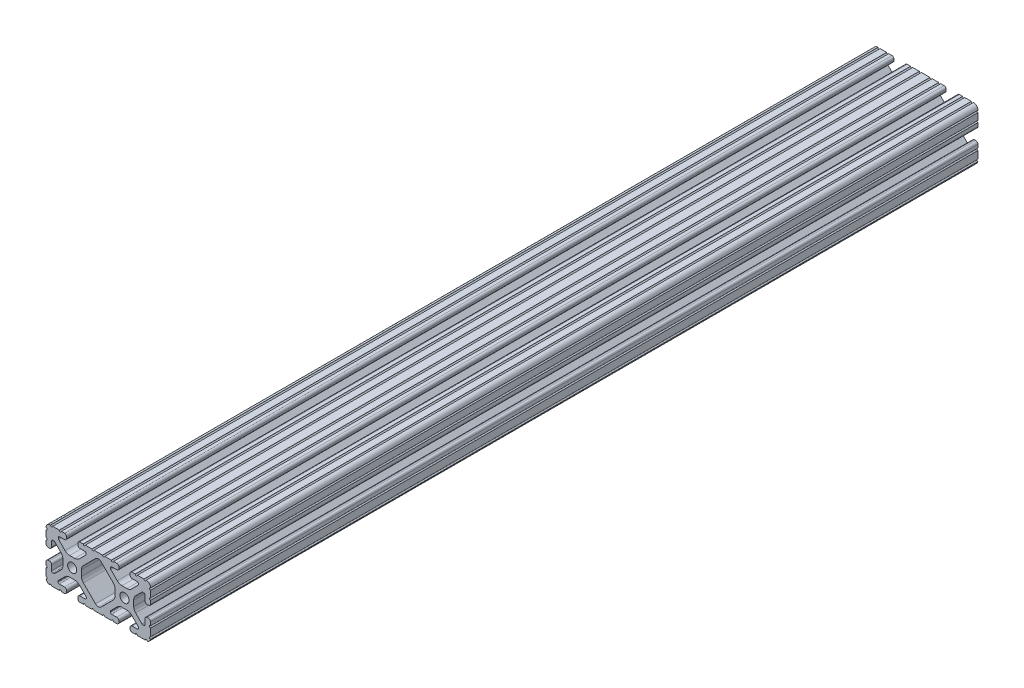
from build123d import *

# Parameters (mm, degrees)
SKETCH1_R      = 3.3274
EXTRUDE1_DEPTH = 603.25


with BuildPart() as part:
    # Sketch1 → Extrude1 (new body)
    with BuildSketch(Plane.XY):
        with BuildLine():
            Line((-3.121121376, -19.05), (3.121121376, -19.05))
            ThreePointArc((3.121121376, -19.05), (3.883121376, -18.288), (4.645121376, -19.05))
            Line((4.645121376, -19.05), (8.633115796, -19.05))
            Line((8.633115796, -19.05), (9.473536067, -19.05))
            ThreePointArc((9.473536067, -19.05), (10.235536067, -18.288), (10.997536067, -19.05))
            Line((10.997536067, -19.05), (13.4112, -19.05))
            ThreePointArc((13.4112, -19.05), (14.524751759, -18.588751759), (14.986, -17.4752))
            Line((14.986, -17.4752), (14.986, -16.5608))
            ThreePointArc((14.986, -16.5608), (14.524751759, -15.447248241), (13.4112, -14.986))
            Line((13.4112, -14.986), (9.652, -14.986))
            ThreePointArc((9.652, -14.986), (9.023382072, -14.725617928), (8.763, -14.097))
            Line((8.763, -14.097), (8.763, -13.687179678))
            ThreePointArc((8.763, -13.687179678), (8.830670671, -13.346975131), (9.023380503, -13.058563318))
            Line((9.023380503, -13.058563318), (13.852498595, -8.229421131))
            ThreePointArc((13.852498595, -8.229421131), (15.393447522, -7.199787805), (17.211122763, -6.838228541))
            Line((17.211122763, -6.838228541), (20.888877237, -6.838228541))
            ThreePointArc((20.888877237, -6.838228541), (22.706552478, -7.199787805), (24.247501405, -8.229421131))
            Line((24.247501405, -8.229421131), (29.076619497, -13.058563318))
            ThreePointArc((29.076619497, -13.058563318), (29.269329329, -13.346975131), (29.337, -13.687179678))
            Line((29.337, -13.687179678), (29.337, -14.097))
            ThreePointArc((29.337, -14.097), (29.076617928, -14.725617928), (28.448, -14.986))
            Line((28.448, -14.986), (24.6888, -14.986))
            ThreePointArc((24.6888, -14.986), (23.575248241, -15.447248241), (23.114, -16.5608))
            Line((23.114, -16.5608), (23.114, -17.4752))
            ThreePointArc((23.114, -17.4752), (23.575248241, -18.588751759), (24.6888, -19.05))
            Line((24.6888, -19.05), (26.945817469, -19.05))
            ThreePointArc((26.945817469, -19.05), (27.707817469, -18.288), (28.469817469, -19.05))
            Line((28.469817469, -19.05), (29.207115796, -19.05))
            Line((29.207115796, -19.05), (34.047273398, -19.05))
            ThreePointArc((34.047273398, -19.05), (34.809273398, -18.288), (35.571273398, -19.05))
            ThreePointArc((35.571273398, -19.05), (37.207577603, -18.182738167), (38.1, -16.560019212))
            ThreePointArc((38.1, -16.560019212), (37.338, -15.798019212), (38.1, -15.036019212))
            Line((38.1, -15.036019212), (38.1, -10.287))
            Line((38.1, -10.287), (38.1, -9.549701672))
            ThreePointArc((38.1, -9.549701672), (37.338, -8.787701672), (38.1, -8.025701672))
            Line((38.1, -8.025701672), (38.1, -5.6388))
            ThreePointArc((38.1, -5.6388), (37.638751759, -4.525248241), (36.5252, -4.064))
            Line((36.5252, -4.064), (35.6108, -4.064))
            ThreePointArc((35.6108, -4.064), (34.497248241, -4.525248241), (34.036, -5.6388))
            Line((34.036, -5.6388), (34.036, -9.398))
            ThreePointArc((34.036, -9.398), (33.775617928, -10.026617928), (33.147, -10.287))
            Line((33.147, -10.287), (32.420656743, -10.287))
            ThreePointArc((32.420656743, -10.287), (32.080450147, -10.21932848), (31.792037247, -10.02661636))
            Line((31.792037247, -10.02661636), (27.197575832, -5.43213202))
            ThreePointArc((27.197575832, -5.43213202), (26.167954729, -3.891188903), (25.8064, -2.07352461))
            Line((25.8064, -2.07352461), (25.8064, 2.07352461))
            ThreePointArc((25.8064, 2.07352461), (26.167954729, 3.891188903), (27.197575832, 5.43213202))
            Line((27.197575832, 5.43213202), (31.792037247, 10.02661636))
            ThreePointArc((31.792037247, 10.02661636), (32.080450147, 10.21932848), (32.420656743, 10.287))
            Line((32.420656743, 10.287), (33.147, 10.287))
            ThreePointArc((33.147, 10.287), (33.775617928, 10.026617928), (34.036, 9.398))
            Line((34.036, 9.398), (34.036, 5.6388))
            ThreePointArc((34.036, 5.6388), (34.497248241, 4.525248241), (35.6108, 4.064))
            Line((35.6108, 4.064), (36.5252, 4.064))
            ThreePointArc((36.5252, 4.064), (37.638751759, 4.525248241), (38.1, 5.6388))
            Line((38.1, 5.6388), (38.1, 8.025701672))
            ThreePointArc((38.1, 8.025701672), (37.338, 8.787701672), (38.1, 9.549701672))
            Line((38.1, 9.549701672), (38.1, 10.287))
            Line((38.1, 10.287), (38.1, 14.375206214))
            ThreePointArc((38.1, 14.375206214), (37.338232276, 15.156019383), (38.137614868, 15.89827725))
            ThreePointArc((38.137614868, 15.89827725), (37.148019028, 18.192014021), (34.819536496, 19.096833012))
            ThreePointArc((34.819536496, 19.096833012), (34.081312886, 18.311776389), (33.296256263, 19.05))
            Line((33.296256263, 19.05), (29.207115796, 19.05))
            Line((29.207115796, 19.05), (28.469817468, 19.05))
            ThreePointArc((28.469817468, 19.05), (27.707817468, 18.288), (26.945817468, 19.05))
            Line((26.945817468, 19.05), (24.558915796, 19.05))
            ThreePointArc((24.558915796, 19.05), (23.53023695, 18.547208069), (23.114, 17.480565346))
            Line((23.114, 17.480565346), (23.114, 16.5608))
            ThreePointArc((23.114, 16.5608), (23.575248241, 15.447248241), (24.6888, 14.986))
            Line((24.6888, 14.986), (28.295243665, 14.986))
            ThreePointArc((28.295243665, 14.986), (28.923861593, 14.725617928), (29.184243665, 14.097))
            Line((29.184243665, 14.097), (29.184243665, 13.53442258))
            ThreePointArc((29.184243665, 13.53442258), (29.116572993, 13.194218033), (28.923863161, 12.90580622))
            Line((28.923863161, 12.90580622), (24.247501405, 8.229421131))
            ThreePointArc((24.247501405, 8.229421131), (22.706552478, 7.199787805), (20.888877237, 6.838228541))
            Line((20.888877237, 6.838228541), (17.211122763, 6.838228541))
            ThreePointArc((17.211122763, 6.838228541), (15.393447522, 7.199787805), (13.852498595, 8.229421131))
            Line((13.852498595, 8.229421131), (9.176136839, 12.90580622))
            ThreePointArc((9.176136839, 12.90580622), (8.983427007, 13.194218033), (8.915756335, 13.53442258))
            Line((8.915756335, 13.53442258), (8.915756335, 14.097))
            ThreePointArc((8.915756335, 14.097), (9.176138407, 14.725617928), (9.804756335, 14.986))
            Line((9.804756335, 14.986), (13.4112, 14.986))
            ThreePointArc((13.4112, 14.986), (14.524751759, 15.447248241), (14.986, 16.5608))
            Line((14.986, 16.5608), (14.986, 17.496772581))
            ThreePointArc((14.986, 17.496772581), (14.531070222, 18.595070222), (13.432772581, 19.05))
            Line((13.432772581, 19.05), (10.997536067, 19.05))
            ThreePointArc((10.997536067, 19.05), (10.235536067, 18.288), (9.473536067, 19.05))
            Line((9.473536067, 19.05), (8.633115796, 19.05))
            Line((8.633115796, 19.05), (4.645121376, 19.05))
            ThreePointArc((4.645121376, 19.05), (3.883121376, 18.288), (3.121121376, 19.05))
            Line((3.121121376, 19.05), (-3.121121376, 19.05))
            ThreePointArc((-3.121121376, 19.05), (-3.883121376, 18.288), (-4.645121376, 19.05))
            Line((-4.645121376, 19.05), (-8.633115796, 19.05))
            Line((-8.633115796, 19.05), (-9.473536067, 19.05))
            ThreePointArc((-9.473536067, 19.05), (-10.235536067, 18.288), (-10.997536067, 19.05))
            Line((-10.997536067, 19.05), (-13.432772581, 19.05))
            ThreePointArc((-13.432772581, 19.05), (-14.531070222, 18.595070222), (-14.986, 17.496772581))
            Line((-14.986, 17.496772581), (-14.986, 16.5608))
            ThreePointArc((-14.986, 16.5608), (-14.524751759, 15.447248241), (-13.4112, 14.986))
            Line((-13.4112, 14.986), (-9.804756335, 14.986))
            ThreePointArc((-9.804756335, 14.986), (-9.176138407, 14.725617928), (-8.915756335, 14.097))
            Line((-8.915756335, 14.097), (-8.915756335, 13.53442258))
            ThreePointArc((-8.915756335, 13.53442258), (-8.983427007, 13.194218033), (-9.176136839, 12.90580622))
            Line((-9.176136839, 12.90580622), (-13.852498595, 8.229421131))
            ThreePointArc((-13.852498595, 8.229421131), (-15.393447522, 7.199787805), (-17.211122763, 6.838228541))
            Line((-17.211122763, 6.838228541), (-20.888877237, 6.838228541))
            ThreePointArc((-20.888877237, 6.838228541), (-22.706552478, 7.199787805), (-24.247501405, 8.229421131))
            Line((-24.247501405, 8.229421131), (-28.923863161, 12.90580622))
            ThreePointArc((-28.923863161, 12.90580622), (-29.116572993, 13.194218033), (-29.184243665, 13.53442258))
            Line((-29.184243665, 13.53442258), (-29.184243665, 14.097))
            ThreePointArc((-29.184243665, 14.097), (-28.923861593, 14.725617928), (-28.295243665, 14.986))
            Line((-28.295243665, 14.986), (-24.6888, 14.986))
            ThreePointArc((-24.6888, 14.986), (-23.575248241, 15.447248241), (-23.114, 16.5608))
            Line((-23.114, 16.5608), (-23.114, 17.480565346))
            ThreePointArc((-23.114, 17.480565346), (-23.53023695, 18.547208069), (-24.558915796, 19.05))
            Line((-24.558915796, 19.05), (-26.945817468, 19.05))
            ThreePointArc((-26.945817468, 19.05), (-27.707817468, 18.288), (-28.469817468, 19.05))
            Line((-28.469817468, 19.05), (-29.207115796, 19.05))
            Line((-29.207115796, 19.05), (-33.296256263, 19.05))
            ThreePointArc((-33.296256263, 19.05), (-34.081312886, 18.311776389), (-34.819536496, 19.096833012))
            ThreePointArc((-34.819536496, 19.096833012), (-37.148019028, 18.192014021), (-38.137614868, 15.89827725))
            ThreePointArc((-38.137614868, 15.89827725), (-37.338232276, 15.156019383), (-38.1, 14.375206214))
            Line((-38.1, 14.375206214), (-38.1, 10.287))
            Line((-38.1, 10.287), (-38.1, 9.549701672))
            ThreePointArc((-38.1, 9.549701672), (-37.338, 8.787701672), (-38.1, 8.025701672))
            Line((-38.1, 8.025701672), (-38.1, 5.6388))
            ThreePointArc((-38.1, 5.6388), (-37.638751759, 4.525248241), (-36.5252, 4.064))
            Line((-36.5252, 4.064), (-35.6108, 4.064))
            ThreePointArc((-35.6108, 4.064), (-34.497248241, 4.525248241), (-34.036, 5.6388))
            Line((-34.036, 5.6388), (-34.036, 9.398))
            ThreePointArc((-34.036, 9.398), (-33.775617928, 10.026617928), (-33.147, 10.287))
            Line((-33.147, 10.287), (-32.420656743, 10.287))
            ThreePointArc((-32.420656743, 10.287), (-32.080450147, 10.21932848), (-31.792037247, 10.02661636))
            Line((-31.792037247, 10.02661636), (-27.197575832, 5.43213202))
            ThreePointArc((-27.197575832, 5.43213202), (-26.167954729, 3.891188903), (-25.8064, 2.07352461))
            Line((-25.8064, 2.07352461), (-25.8064, -2.07352461))
            ThreePointArc((-25.8064, -2.07352461), (-26.167954729, -3.891188903), (-27.197575832, -5.43213202))
            Line((-27.197575832, -5.43213202), (-31.792037247, -10.02661636))
            ThreePointArc((-31.792037247, -10.02661636), (-32.080450147, -10.21932848), (-32.420656743, -10.287))
            Line((-32.420656743, -10.287), (-33.147, -10.287))
            ThreePointArc((-33.147, -10.287), (-33.775617928, -10.026617928), (-34.036, -9.398))
            Line((-34.036, -9.398), (-34.036, -5.6388))
            ThreePointArc((-34.036, -5.6388), (-34.497248241, -4.525248241), (-35.6108, -4.064))
            Line((-35.6108, -4.064), (-36.5252, -4.064))
            ThreePointArc((-36.5252, -4.064), (-37.638751759, -4.525248241), (-38.1, -5.6388))
            Line((-38.1, -5.6388), (-38.1, -8.025701672))
            ThreePointArc((-38.1, -8.025701672), (-37.338, -8.787701672), (-38.1, -9.549701672))
            Line((-38.1, -9.549701672), (-38.1, -10.287))
            Line((-38.1, -10.287), (-38.1, -15.036019212))
            ThreePointArc((-38.1, -15.036019212), (-37.338, -15.798019212), (-38.1, -16.560019212))
            ThreePointArc((-38.1, -16.560019212), (-37.20882252, -18.184002456), (-35.571273398, -19.05))
            ThreePointArc((-35.571273398, -19.05), (-34.809273398, -18.288), (-34.047273398, -19.05))
            Line((-34.047273398, -19.05), (-29.207115796, -19.05))
            Line((-29.207115796, -19.05), (-28.469817469, -19.05))
            ThreePointArc((-28.469817469, -19.05), (-27.707817469, -18.288), (-26.945817469, -19.05))
            Line((-26.945817469, -19.05), (-24.6888, -19.05))
            ThreePointArc((-24.6888, -19.05), (-23.575248241, -18.588751759), (-23.114, -17.4752))
            Line((-23.114, -17.4752), (-23.114, -16.5608))
            ThreePointArc((-23.114, -16.5608), (-23.575248241, -15.447248241), (-24.6888, -14.986))
            Line((-24.6888, -14.986), (-28.448, -14.986))
            ThreePointArc((-28.448, -14.986), (-29.076617928, -14.725617928), (-29.337, -14.097))
            Line((-29.337, -14.097), (-29.337, -13.687179678))
            ThreePointArc((-29.337, -13.687179678), (-29.269329329, -13.346975131), (-29.076619497, -13.058563318))
            Line((-29.076619497, -13.058563318), (-24.247501405, -8.229421131))
            ThreePointArc((-24.247501405, -8.229421131), (-22.706552478, -7.199787805), (-20.888877237, -6.838228541))
            Line((-20.888877237, -6.838228541), (-17.211122763, -6.838228541))
            ThreePointArc((-17.211122763, -6.838228541), (-15.393447522, -7.199787805), (-13.852498595, -8.229421131))
            Line((-13.852498595, -8.229421131), (-9.023380503, -13.058563318))
            ThreePointArc((-9.023380503, -13.058563318), (-8.830670671, -13.346975131), (-8.763, -13.687179678))
            Line((-8.763, -13.687179678), (-8.763, -14.097))
            ThreePointArc((-8.763, -14.097), (-9.023382072, -14.725617928), (-9.652, -14.986))
            Line((-9.652, -14.986), (-13.4112, -14.986))
            ThreePointArc((-13.4112, -14.986), (-14.524751759, -15.447248241), (-14.986, -16.5608))
            Line((-14.986, -16.5608), (-14.986, -17.4752))
            ThreePointArc((-14.986, -17.4752), (-14.524751759, -18.588751759), (-13.4112, -19.05))
            Line((-13.4112, -19.05), (-10.997536067, -19.05))
            ThreePointArc((-10.997536067, -19.05), (-10.235536067, -18.288), (-9.473536067, -19.05))
            Line((-9.473536067, -19.05), (-8.633115796, -19.05))
            Line((-8.633115796, -19.05), (-4.645121376, -19.05))
            ThreePointArc((-4.645121376, -19.05), (-3.883121376, -18.288), (-3.121121376, -19.05))
        make_face()
        with Locations((19.05, 0)):
            Circle(SKETCH1_R, mode=Mode.SUBTRACT)
        with Locations(Location((-19.05, 0, 0), (0, 0, 180))):
            Circle(SKETCH1_R, mode=Mode.SUBTRACT)
        with BuildLine():
            Line((2.077035361, 14.257564863), (10.902424168, 5.43213202))
            ThreePointArc((10.902424168, 5.43213202), (11.932045271, 3.891188903), (12.2936, 2.07352461))
            Line((12.2936, 2.07352461), (12.2936, -2.07352461))
            ThreePointArc((12.2936, -2.07352461), (11.932045271, -3.891188903), (10.902424168, -5.43213202))
            Line((10.902424168, -5.43213202), (2.077035361, -14.257564863))
            ThreePointArc((2.077035361, -14.257564863), (1.124045601, -14.892973012), (0, -15.113096807))
            ThreePointArc((0, -15.113096807), (-1.124045601, -14.892973012), (-2.077035361, -14.257564863))
            Line((-2.077035361, -14.257564863), (-10.902424168, -5.43213202))
            ThreePointArc((-10.902424168, -5.43213202), (-11.932045271, -3.891188903), (-12.2936, -2.07352461))
            Line((-12.2936, -2.07352461), (-12.2936, 2.07352461))
            ThreePointArc((-12.2936, 2.07352461), (-11.932045271, 3.891188903), (-10.902424168, 5.43213202))
            Line((-10.902424168, 5.43213202), (-2.077035361, 14.257564863))
            ThreePointArc((-2.077035361, 14.257564863), (-1.124045601, 14.892973012), (0, 15.113096807))
            ThreePointArc((0, 15.113096807), (1.124045601, 14.892973012), (2.077035361, 14.257564863))
        make_face(mode=Mode.SUBTRACT)
    extrude(amount=-EXTRUDE1_DEPTH)


solid = part.part
